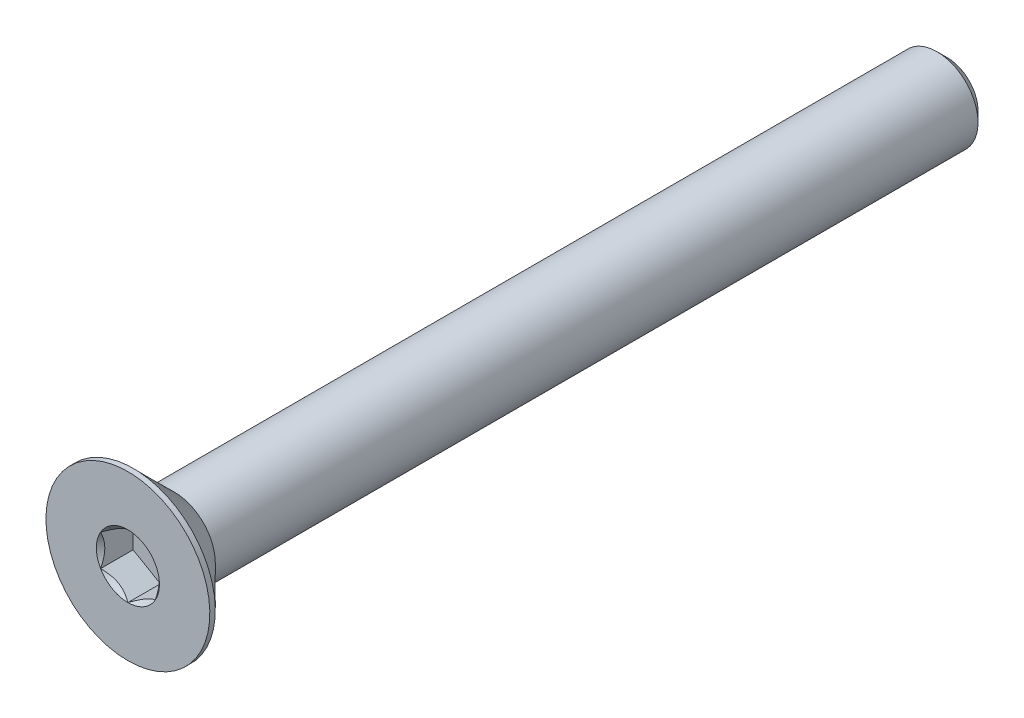
from build123d import *

# Parameters (mm, degrees)
SKETCH1_W          = 30
SKETCH1_H          = 1.5
CHAMFER1_SIZE      = 0.375
CUT_EXTRUDE2_DEPTH = 1.19


with BuildPart() as part:
    # Sketch1 → Revolve1 (revolve)
    with BuildSketch(Plane(origin=(0, 0, 0), x_dir=(0, 0, -1), z_dir=(1, 0, 0))):
        with Locations((15, 0.75)):
            Rectangle(SKETCH1_W, SKETCH1_H)
    revolve(axis=Axis((0, 0, -30), (0, 0, 1)))

    # Chamfer1
    chamfer1_edges = [part.edges().sort_by_distance(p)[0] for p in [
        (0, -1.5, -30),
    ]]
    chamfer(chamfer1_edges, length=CHAMFER1_SIZE)

    # Sketch7 → Revolve2 (revolve)
    with BuildSketch(Plane(origin=(0, 0, 0), x_dir=(0, 0, -1), z_dir=(1, 0, 0)), mode=Mode.PRIVATE) as revolve2_sk:
        Polygon((0, 3), (0.2, 3), (1.7, 1.5), (1.7, 0), (0, 0), align=None)
    revolve(revolve2_sk.sketch.rotate(Axis((0, 0, 0), (0, 0, -1)), 180), axis=Axis((0, 0, 0), (0, 0, -1)))

    # Boss-Extrude1 cone 1 section (through the dimple's axis) → Boss-Extrude1 (revolve)
    with BuildSketch(Plane(origin=(0, 0, -1.7), x_dir=(0, -1, 0), z_dir=(1, 0, 0))):
        Polygon((0, 0), (1.5, 0), (0, 1.5), align=None)
    revolve(axis=Axis((0, 0, -1.7), (0, 0, -1)))

    # Sketch5 → Cut-Extrude2 (cut)
    with BuildSketch(Plane.XY):
        Polygon((1, -0.577350269), (1, 0.577350269), (0, 1.154700538), (-1, 0.577350269), (-1, -0.577350269), (0, -1.154700538), align=None)
    extrude(amount=-CUT_EXTRUDE2_DEPTH, mode=Mode.SUBTRACT)

    # Cut-Extrude3 cone 1 section (through the dimple's axis) → Cut-Extrude3 (revolve, cut)
    with BuildSketch(Plane(origin=(0, 0, 0), x_dir=(0, -1, 0), z_dir=(1, 0, 0))):
        Polygon((0, 0), (1.154700538, 0), (0, 1.154700538), align=None)
    revolve(axis=Axis((0, 0, 0), (0, 0, -1)), mode=Mode.SUBTRACT)


solid = part.part
